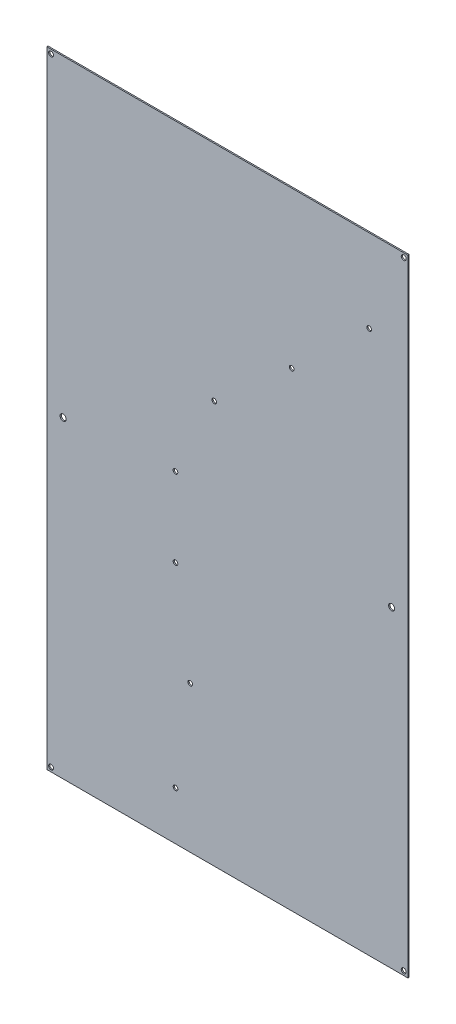
from build123d import *

# Parameters (mm, degrees)
SKETCH1_W           = 466
SKETCH1_H           = 807.900101531
SKETCH1_R           = 3.175
SKETCH1_R_2         = 3.96875
SKETCH1_R_3         = 3
BOSS_EXTRUDE1_DEPTH = 1.6002


with BuildPart() as part:
    # Sketch1 → Boss-Extrude1 (new body)
    with BuildSketch(Plane.XY):
        with Locations((125.152406859, 514.031444865)):
            Rectangle(SKETCH1_W, SKETCH1_H)
        with Locations((-102.405393141, 115.522426029)):
            Circle(SKETCH1_R, mode=Mode.SUBTRACT)
        with Locations((352.710206859, 115.522426029)):
            Circle(SKETCH1_R, mode=Mode.SUBTRACT)
        with Locations((-102.405393141, 912.54036218)):
            Circle(SKETCH1_R, mode=Mode.SUBTRACT)
        with Locations((352.710206859, 912.54036218)):
            Circle(SKETCH1_R, mode=Mode.SUBTRACT)
        with Locations((-86.893613141, 514.031444864)):
            Circle(SKETCH1_R_2, mode=Mode.SUBTRACT)
        with Locations((337.198426859, 514.031444864)):
            Circle(SKETCH1_R_2, mode=Mode.SUBTRACT)
        with Locations((308.152406859, 811.15549563)):
            Circle(SKETCH1_R_3, mode=Mode.SUBTRACT)
        with Locations((208.152406859, 716.58349563)):
            Circle(SKETCH1_R_3, mode=Mode.SUBTRACT)
        with Locations((108.152406859, 630.07849563)):
            Circle(SKETCH1_R_3, mode=Mode.SUBTRACT)
        with Locations((58.152406859, 526.39349563)):
            Circle(SKETCH1_R_3, mode=Mode.SUBTRACT)
        with Locations((77.152406859, 298.98149563)):
            Circle(SKETCH1_R_3, mode=Mode.SUBTRACT)
        with Locations((58.186406859, 172.67049563)):
            Circle(SKETCH1_R_3, mode=Mode.SUBTRACT)
        with Locations((58.186406859, 424.37449563)):
            Circle(SKETCH1_R_3, mode=Mode.SUBTRACT)
    extrude(amount=BOSS_EXTRUDE1_DEPTH)


solid = part.part
